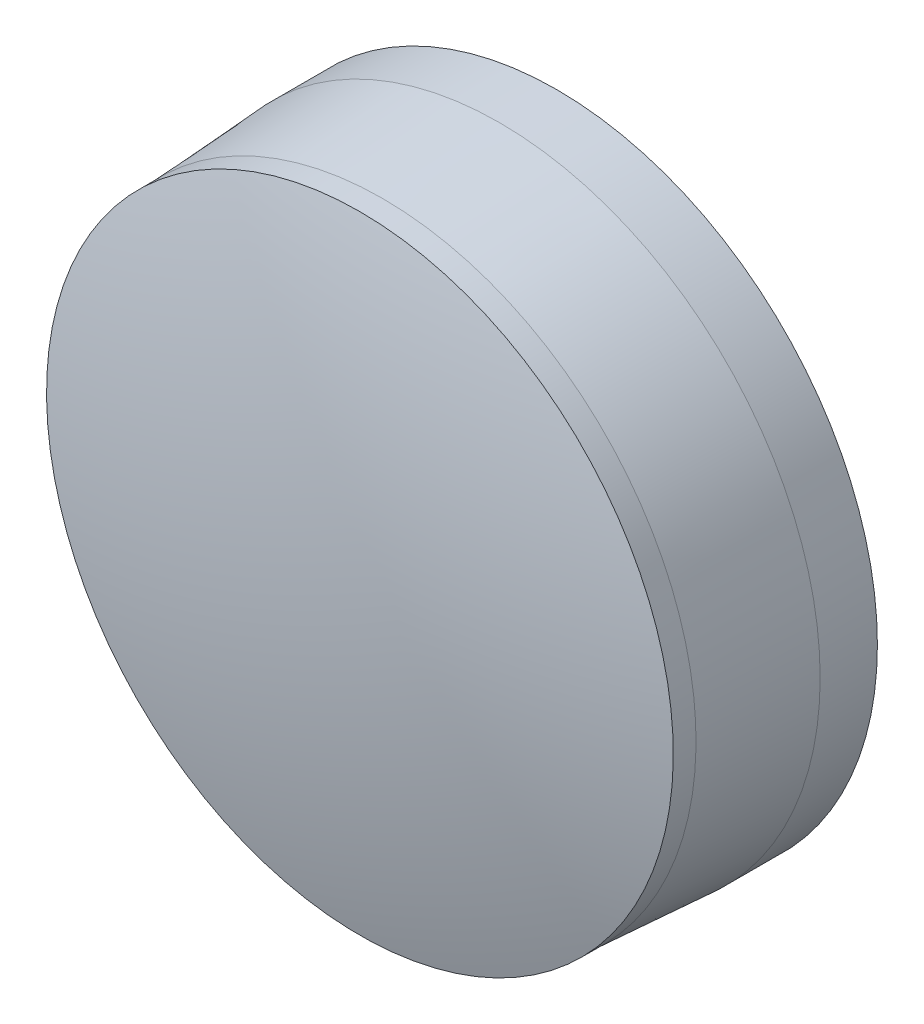
from build123d import *


with BuildPart() as part:
    # Sketch1 → Revolve1 (revolve)
    with BuildSketch(Plane(origin=(0, 0, 0), x_dir=(0, 0, -1), z_dir=(1, 0, 0))):
        with BuildLine():
            Line((-4.49999987, 0), (0, 0))
            ThreePointArc((0, 0), (-0.085424611, 2.805197924), (-0.341381868, 5.6))
            Line((-0.341381868, 5.6), (-1.341381868, 5.6))
            Line((-1.341381868, 5.6), (-3.385113802, 5.475))
            Line((-3.385113802, 5.475), (-3.782515337, 5.475))
            ThreePointArc((-3.782515337, 5.475), (-4.319865175, 2.760906058), (-4.49999987, 0))
        make_face()
    revolve(axis=Axis((0, 0, -11.266779681), (0, 0, 1)))


solid = part.part
